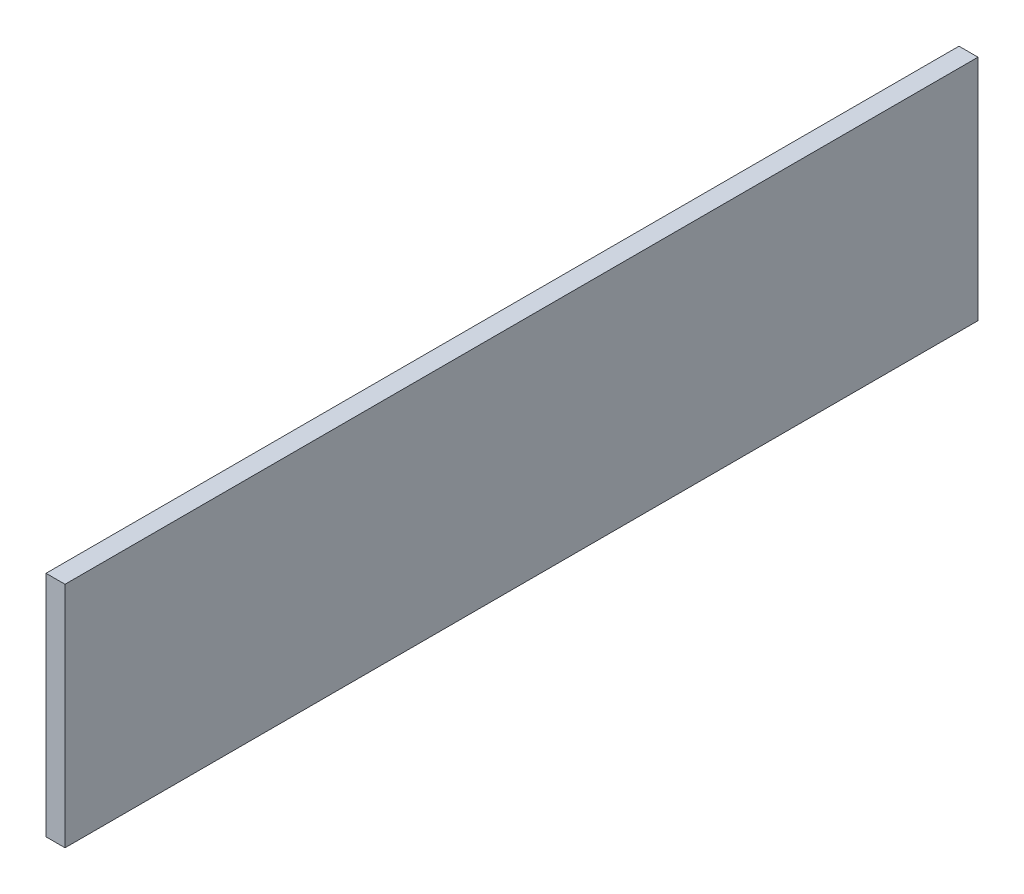
from build123d import *

# Parameters (mm, degrees)
SKETCH1_W           = 304.8
SKETCH1_H           = 76.2
BOSS_EXTRUDE1_DEPTH = 6.35


with BuildPart() as part:
    # Sketch1 → Boss-Extrude1 (new body)
    with BuildSketch(Plane(origin=(0, 0, 0), x_dir=(0, 0, -1), z_dir=(1, 0, 0))):
        Rectangle(SKETCH1_W, SKETCH1_H)
    extrude(amount=BOSS_EXTRUDE1_DEPTH)


solid = part.part
